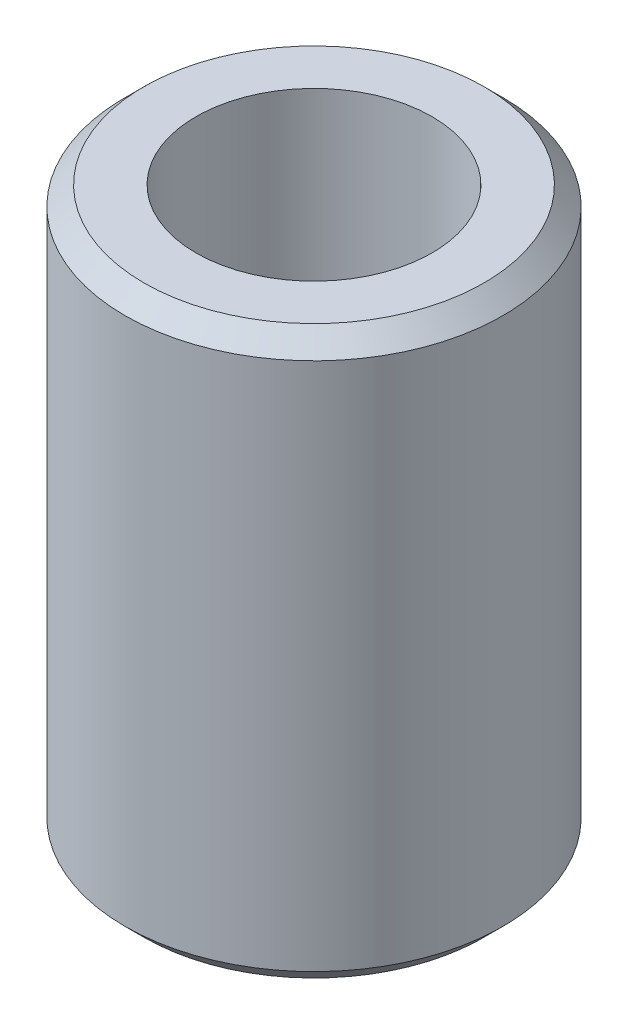
from build123d import *

# Parameters (mm, degrees)
SKETCH2_R           = 20
SKETCH2_R_2         = 12.5
BOSS_EXTRUDE1_DEPTH = 30
CHAMFER1_SIZE       = 2


with BuildPart() as part:
    # Sketch2 → Boss-Extrude1 (new, symmetric)
    with BuildSketch(Plane(origin=(0, 0, 0), x_dir=(1, 0, 0), z_dir=(0, 1, 0))):
        with Locations(Location((0, 0, 0), (0, 0, 270))):
            Circle(SKETCH2_R)
        with Locations(Location((0, 0, 0), (0, 0, 270))):
            Circle(SKETCH2_R_2, mode=Mode.SUBTRACT)
    extrude(amount=BOSS_EXTRUDE1_DEPTH, both=True)

    # Chamfer1
    chamfer1_edges = [part.edges().sort_by_distance(p)[0] for p in [
        (0, -30, -20),
        (0, 30, -20),
    ]]
    chamfer(chamfer1_edges, length=CHAMFER1_SIZE)


solid = part.part
